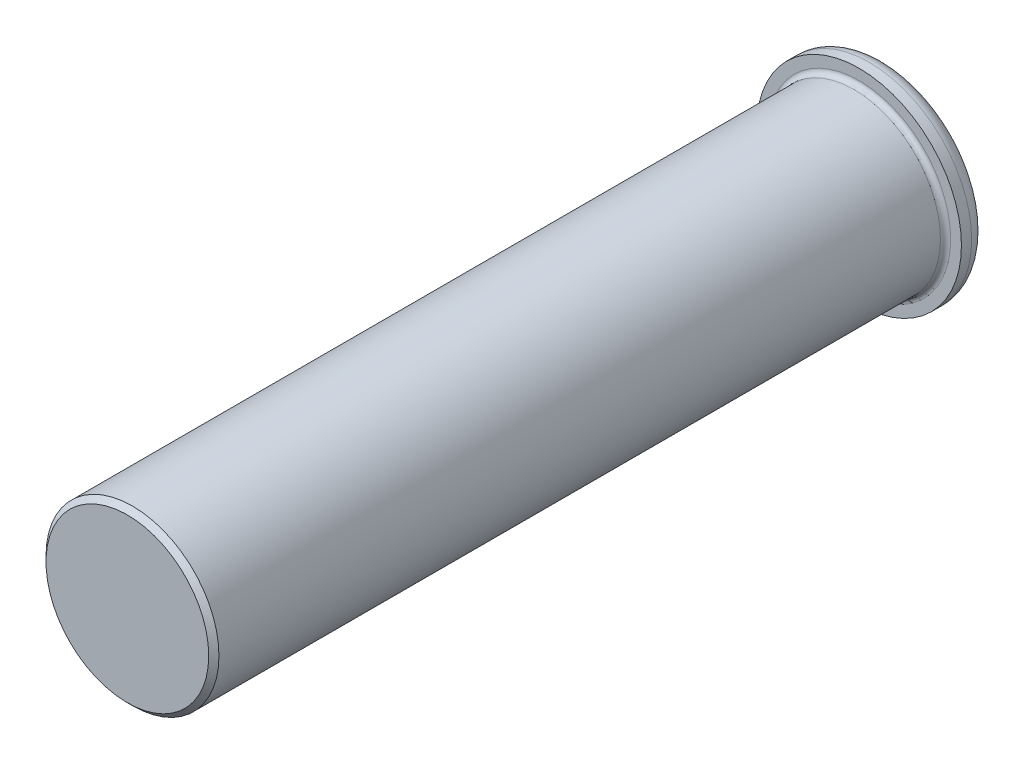
from build123d import *

# Parameters (mm, degrees)
SCHIZZO1_R                   = 10
ESTRUSIONE_ESTRUSIONE1_DEPTH = 2.5
SCHIZZO2_R                   = 8.45
ESTRUSIONE_ESTRUSIONE2_DEPTH = 71.5
RACCORDO1_R                  = 0.5
SMUSSO2_SIZE                 = 0.5
RACCORDO3_R                  = 1.5


with BuildPart() as part:
    # Schizzo1 → Estrusione-Estrusione1 (new body)
    with BuildSketch(Plane.XY):
        with Locations((0, 2.505612013)):
            Circle(SCHIZZO1_R)
    extrude(amount=ESTRUSIONE_ESTRUSIONE1_DEPTH)

    # Schizzo2 → Estrusione-Estrusione2 (add)
    with BuildSketch(Plane.XY.offset(2.5)):
        with Locations((0, 2.505612013)):
            Circle(SCHIZZO2_R)
    extrude(amount=ESTRUSIONE_ESTRUSIONE2_DEPTH)

    # Raccordo1
    raccordo1_edges = [part.edges().sort_by_distance(p)[0] for p in [
        (-8.45, 2.505612013, 2.5),
    ]]
    fillet(raccordo1_edges, radius=RACCORDO1_R)

    # Smusso2
    smusso2_edges = [part.edges().sort_by_distance(p)[0] for p in [
        (-8.45, 2.505612013, 74),
    ]]
    chamfer(smusso2_edges, length=SMUSSO2_SIZE)

    # Raccordo3
    raccordo3_edges = [part.edges().sort_by_distance(p)[0] for p in [
        (-10, 2.505612013, 0),
    ]]
    fillet(raccordo3_edges, radius=RACCORDO3_R)


solid = part.part
